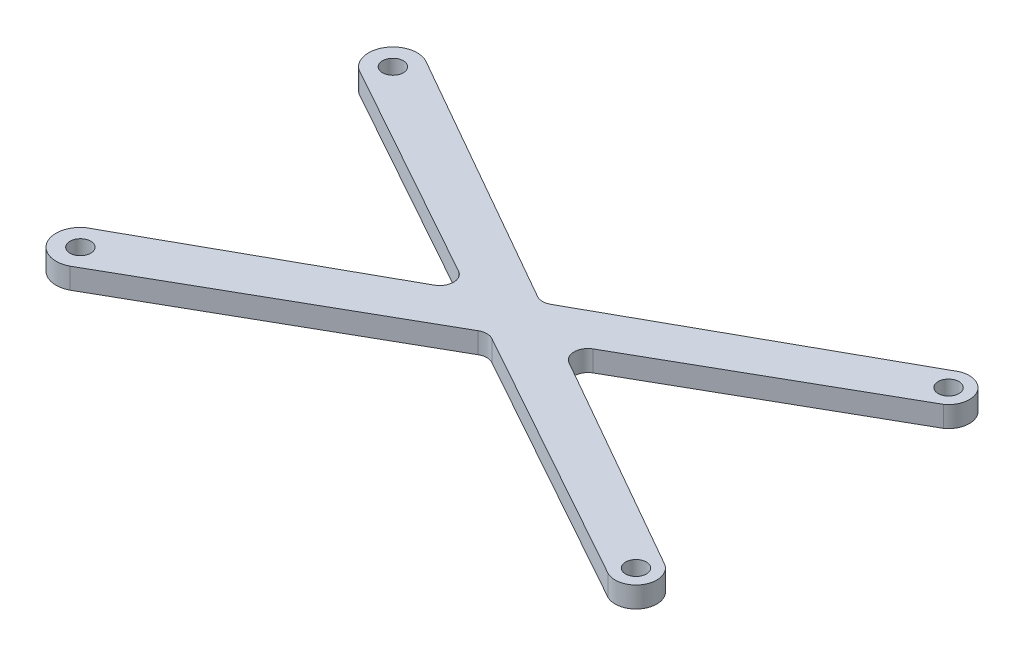
from build123d import *

# Parameters (mm, degrees)
SKETCH1_R           = 1.5
BOSS_EXTRUDE1_DEPTH = 3


with BuildPart() as part:
    # Sketch1 → Boss-Extrude1 (new body)
    with BuildSketch(Plane(origin=(0, 0, 0), x_dir=(1, 0, 0), z_dir=(0, 1, 0))):
        with BuildLine():
            Line((1.622439175, 48.101240256), (39.053372501, 26.771718527))
            ThreePointArc((39.053372501, 26.771718527), (40.032887341, 26.509423591), (41.015146868, 26.761245306))
            Line((41.015146868, 26.761245306), (78.67168168, 47.689901567))
            ThreePointArc((78.67168168, 47.689901567), (82.583163512, 46.525538027), (81.7142336, 42.538008293))
            Line((81.7142336, 42.538008293), (49.599191101, 24.237676564))
            ThreePointArc((49.599191101, 24.237676564), (48.589383082, 22.5), (49.599191101, 20.762323436))
            Line((49.599191101, 20.762323436), (81.7142336, 2.461991707))
            ThreePointArc((81.7142336, 2.461991707), (82.583163512, -1.525538027), (78.67168168, -2.689901567))
            Line((78.67168168, -2.689901567), (41.015146868, 18.238754694))
            ThreePointArc((41.015146868, 18.238754694), (40.032887341, 18.490576409), (39.053372501, 18.228281473))
            Line((39.053372501, 18.228281473), (1.622439175, -3.101240256))
            ThreePointArc((1.622439175, -3.101240256), (-2.958245931, -1.870502877), (-2.106048262, 2.79545358))
            Line((-2.106048262, 2.79545358), (30.202556102, 20.751850216))
            ThreePointArc((30.202556102, 20.751850216), (31.230973717, 22.5), (30.202556102, 24.248149784))
            Line((30.202556102, 24.248149784), (-2.106048262, 42.20454642))
            ThreePointArc((-2.106048262, 42.20454642), (-2.958245931, 46.870502877), (1.622439175, 48.101240256))
        make_face()
        with Locations(Location((0, 45, 0), (0, 0, 270))):
            Circle(SKETCH1_R, mode=Mode.SUBTRACT)
        with Locations(Location((80, 45, 0), (0, 0, 270))):
            Circle(SKETCH1_R, mode=Mode.SUBTRACT)
        with Locations(Location((80, 0, 0), (0, 0, 270))):
            Circle(SKETCH1_R, mode=Mode.SUBTRACT)
        with Locations(Location((0, 0, 0), (0, 0, 270))):
            Circle(SKETCH1_R, mode=Mode.SUBTRACT)
    extrude(amount=BOSS_EXTRUDE1_DEPTH)


solid = part.part
